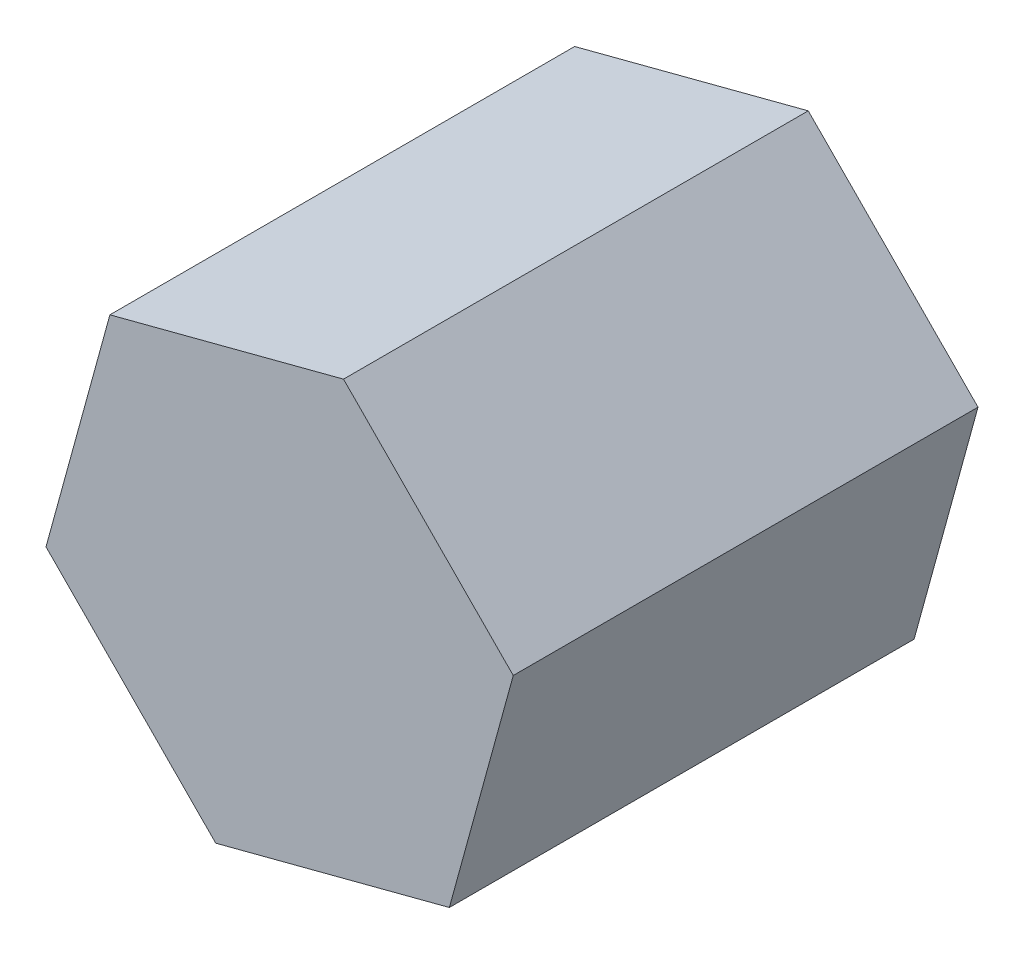
from build123d import *

# Parameters (mm, degrees)
BOSS_EXTRUDE1_DEPTH = 6


with BuildPart() as part:
    # Sketch1 → Boss-Extrude1 (new body)
    with BuildSketch(Plane.XY):
        Polygon((104.657663983, -30.511529553), (101.641427362, -31.300400041), (100.816490934, -34.306972822), (103.007791127, -36.524675116), (106.024027748, -35.735804628), (106.848964176, -32.729231847), align=None)
    extrude(amount=BOSS_EXTRUDE1_DEPTH)


solid = part.part
